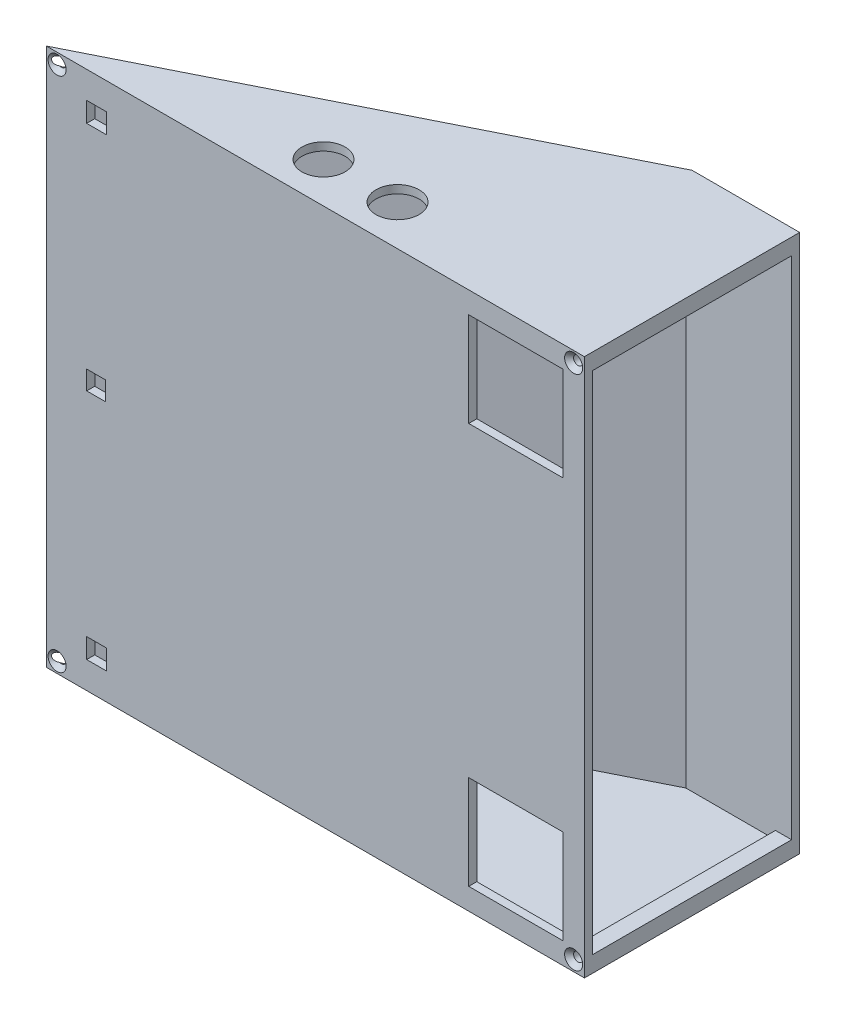
from build123d import *

# Parameters (mm, degrees)
SALIENTE_EXTRUIR2_DEPTH = 200
VACIADO2_T              = -3
CROQUIS6_R              = 8.2
CORTAR_EXTRUIR4_DEPTH   = 80
CROQUIS2_R              = 8.02
CORTAR_EXTRUIR5_DEPTH   = 3
CORTAR_EXTRUIR6_START   = -3
CROQUIS5_R              = 8.02
CORTAR_EXTRUIR6_DEPTH   = 3
CROQUIS7_W              = 7.4
CROQUIS7_H              = 7.4
CORTAR_EXTRUIR11_DEPTH  = 3
CROQUIS8_W              = 7.04
CROQUIS8_H              = 7.04
CORTAR_EXTRUIR12_DEPTH  = 3
CROQUIS9_W              = 35
CROQUIS9_H              = 35
CORTAR_EXTRUIR13_DEPTH  = 3
CROQUIS15_W             = 6
CROQUIS15_H             = 3
SALIENTE_EXTRUIR3_DEPTH = 75


with BuildPart() as part:
    # Croquis1 → Saliente-Extruir2 (new body)
    with BuildSketch(Plane(origin=(0, 0, 0), x_dir=(1, 0, 0), z_dir=(0, 1, 0))):
        Polygon((0, 0), (200, 0), (200, 80), (160, 80), align=None)
    extrude(amount=SALIENTE_EXTRUIR2_DEPTH)

    # Vaciado2
    vaciado2_openings = [part.faces().sort_by_distance(p)[0] for p in [
        (200, 100, -40),
    ]]
    offset(amount=VACIADO2_T, openings=vaciado2_openings, kind=Kind.INTERSECTION)

    # Croquis6 → Cortar-Extruir4 (cut)
    with BuildSketch(Plane(origin=(0, 0, 0), x_dir=(0, 0, -1), z_dir=(1, 0, 0))):
        with Locations(Location((30, 88.575, 0), (0, 0, 180))):
            Circle(CROQUIS6_R)
        with Locations(Location((30, 111.425, 0), (0, 0, 180))):
            Circle(CROQUIS6_R)
    extrude(amount=CORTAR_EXTRUIR4_DEPTH, mode=Mode.SUBTRACT)

    # Croquis2 → Cortar-Extruir5 (cut)
    with BuildSketch(Plane(origin=(0, 200, 0), x_dir=(1, 0, 0), z_dir=(0, 1, 0))):
        with Locations(Location((88.011571484, 15, 0), (0, 0, 270))):
            Circle(CROQUIS2_R)
        with Locations(Location((115.531571484, 15, 0), (0, 0, 270))):
            Circle(CROQUIS2_R)
    extrude(amount=-CORTAR_EXTRUIR5_DEPTH, mode=Mode.SUBTRACT)

    # Croquis5 → Cortar-Extruir6 (cut)
    with BuildSketch(Plane.XZ.offset(CORTAR_EXTRUIR6_START)):
        with Locations(Location((88.011571484, -15, 0), (0, 0, 90))):
            Circle(CROQUIS5_R)
        with Locations(Location((115.531571484, -15, 0), (0, 0, 90))):
            Circle(CROQUIS5_R)
    extrude(amount=CORTAR_EXTRUIR6_DEPTH, mode=Mode.SUBTRACT)

    # Croquis7 → Cortar-Extruir11 (cut)
    with BuildSketch(Plane.XY):
        with Locations((18.7, 13.7)):
            Rectangle(CROQUIS7_W, CROQUIS7_H)
    cortar_extruir11 = extrude(amount=-CORTAR_EXTRUIR11_DEPTH, mode=Mode.SUBTRACT)

    # Simetría5: Cortar-Extruir11 across plane
    add(cortar_extruir11.mirror(Plane.ZX.offset(100)), mode=Mode.SUBTRACT)

    # Croquis8 → Cortar-Extruir12 (cut)
    with BuildSketch(Plane.XY):
        with Locations((18.52, 100)):
            Rectangle(CROQUIS8_W, CROQUIS8_H)
    extrude(amount=-CORTAR_EXTRUIR12_DEPTH, mode=Mode.SUBTRACT)

    # Croquis9 → Cortar-Extruir13 (cut)
    with BuildSketch(Plane.XY):
        with Locations((174.5, 174.5)):
            Rectangle(CROQUIS9_W, CROQUIS9_H)
    cortar_extruir13 = extrude(amount=-CORTAR_EXTRUIR13_DEPTH, mode=Mode.SUBTRACT)

    # Simetría6: Cortar-Extruir13 across plane
    add(cortar_extruir13.mirror(Plane.ZX.offset(100)), mode=Mode.SUBTRACT)

    # Croquis15 → Saliente-Extruir3 (add)
    with BuildSketch(Plane(origin=(0, 0, -3), x_dir=(-1, 0, 0), z_dir=(0, 0, -1))):
        with Locations((-197, 4.5)):
            Rectangle(CROQUIS15_W, CROQUIS15_H)
    saliente_extruir3 = extrude(amount=SALIENTE_EXTRUIR3_DEPTH)

    # Simetría7: Saliente-Extruir3 across plane
    add(saliente_extruir3.mirror(Plane.ZX.offset(100)))

    # Croquis18 → Refrentado para tornillo tapón con cabeza plana de clavija de M33 (revolve, cut)
    with BuildSketch(Plane(origin=(196, 4, 0), x_dir=(0, -1, 0), z_dir=(1, 0, 0))):
        Polygon((0, 0), (0, 11.021463052), (1.7, 10), (1.7, 1.66), (3.36, 0), align=None)
    refrentado_para_tornillo_tap_n_con_cabez = revolve(axis=Axis((196, 4, 6.35), (0, 0, -1)), mode=Mode.SUBTRACT)

    # Simetría8: Refrentado para tornillo tapón con cabeza plana de clavija de M33 across plane
    add(refrentado_para_tornillo_tap_n_con_cabez.mirror(Plane.ZX.offset(100)), mode=Mode.SUBTRACT)

    # Simetría9: Refrentado para tornillo tapón con cabeza plana de clavija de M33 across plane
    add(refrentado_para_tornillo_tap_n_con_cabez.mirror(Plane(origin=(100, 0, 0), x_dir=(0, 0, 1), z_dir=(1, 0, 0))), mode=Mode.SUBTRACT)

    # Simetría9 copy 1 sketch → Simetría9 copy 1 (revolve, cut)
    with BuildSketch(Plane(origin=(4, 196, 0), x_dir=(0, 1, 0), z_dir=(-1, 0, 0))):
        Polygon((0, 0), (0, 11.021463052), (1.7, 10), (1.7, 1.66), (3.36, 0), align=None)
    revolve(axis=Axis((4, 196, 6.35), (0, 0, -1)), mode=Mode.SUBTRACT)


solid = part.part
